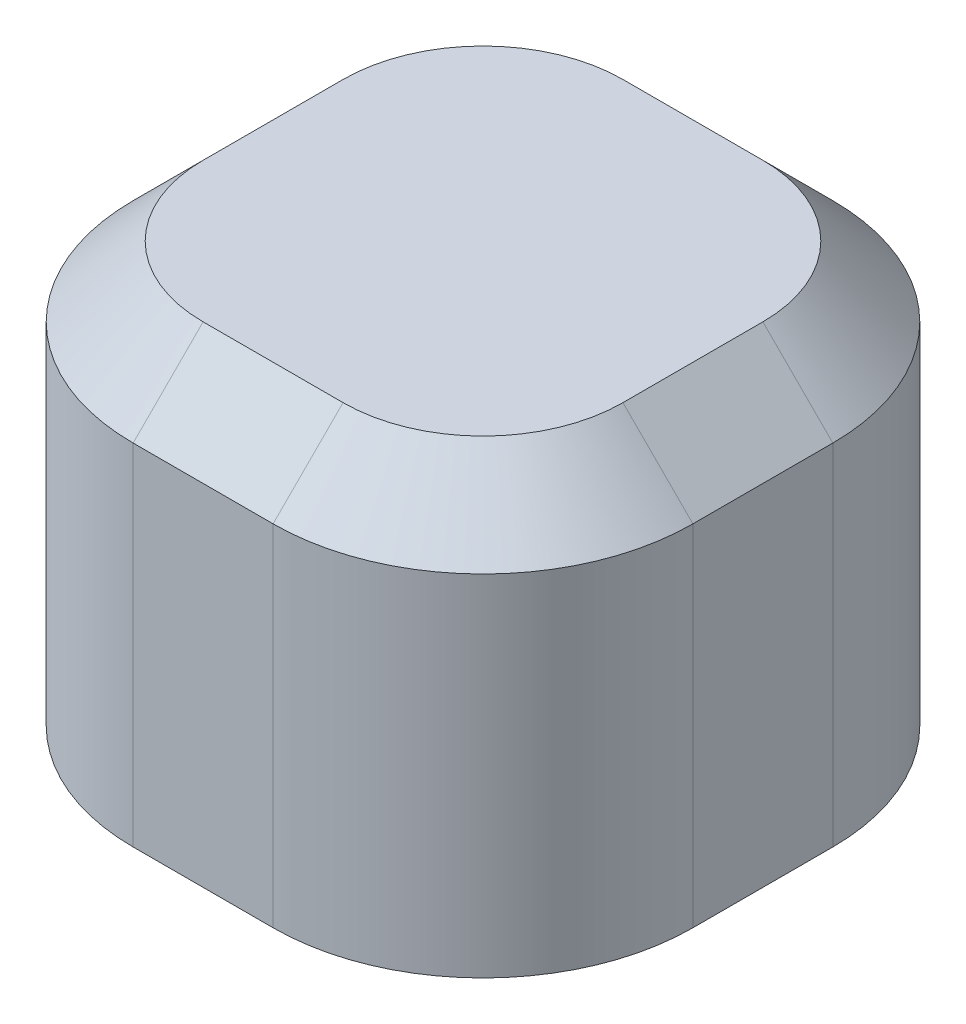
from build123d import *

# Parameters (mm, degrees)
CROQUIS1_W              = 4
CROQUIS1_H              = 4
SALIENTE_EXTRUIR1_DEPTH = 3
CROQUIS2_W              = 3
CROQUIS2_H              = 3
CORTAR_EXTRUIR1_DEPTH   = 1.5
REDONDEO1_R             = 1.5
CHAFL_N1_SIZE           = 0.5


with BuildPart() as part:
    # Croquis1 → Saliente-Extruir1 (new body)
    with BuildSketch(Plane(origin=(0, 0, 0), x_dir=(1, 0, 0), z_dir=(0, 1, 0))):
        with Locations((2, 2)):
            Rectangle(CROQUIS1_W, CROQUIS1_H)
    extrude(amount=SALIENTE_EXTRUIR1_DEPTH)

    # Croquis2 → Cortar-Extruir1 (cut)
    with BuildSketch(Plane.XZ):
        with Locations((2, -2)):
            Rectangle(CROQUIS2_W, CROQUIS2_H)
    extrude(amount=-CORTAR_EXTRUIR1_DEPTH, mode=Mode.SUBTRACT)

    # Redondeo1
    redondeo1_edges = [part.edges().sort_by_distance(p)[0] for p in [
        (0, 1.5, -4),
        (4, 1.5, -4),
        (4, 1.5, 0),
        (0, 1.5, 0),
    ]]
    fillet(redondeo1_edges, radius=REDONDEO1_R)

    # Chaflán1
    chafl_n1_edges = [part.edges().sort_by_distance(p)[0] for p in [
        (2, 3, 0),
        (0, 3, -2),
        (4, 3, -2),
        (2, 3, -4),
        (3.560660172, 3, -0.439339828),
        (3.560660172, 3, -3.560660172),
        (0.439339828, 3, -3.560660172),
        (0.439339828, 3, -0.439339828),
    ]]
    chamfer(chafl_n1_edges, length=CHAFL_N1_SIZE)


solid = part.part
